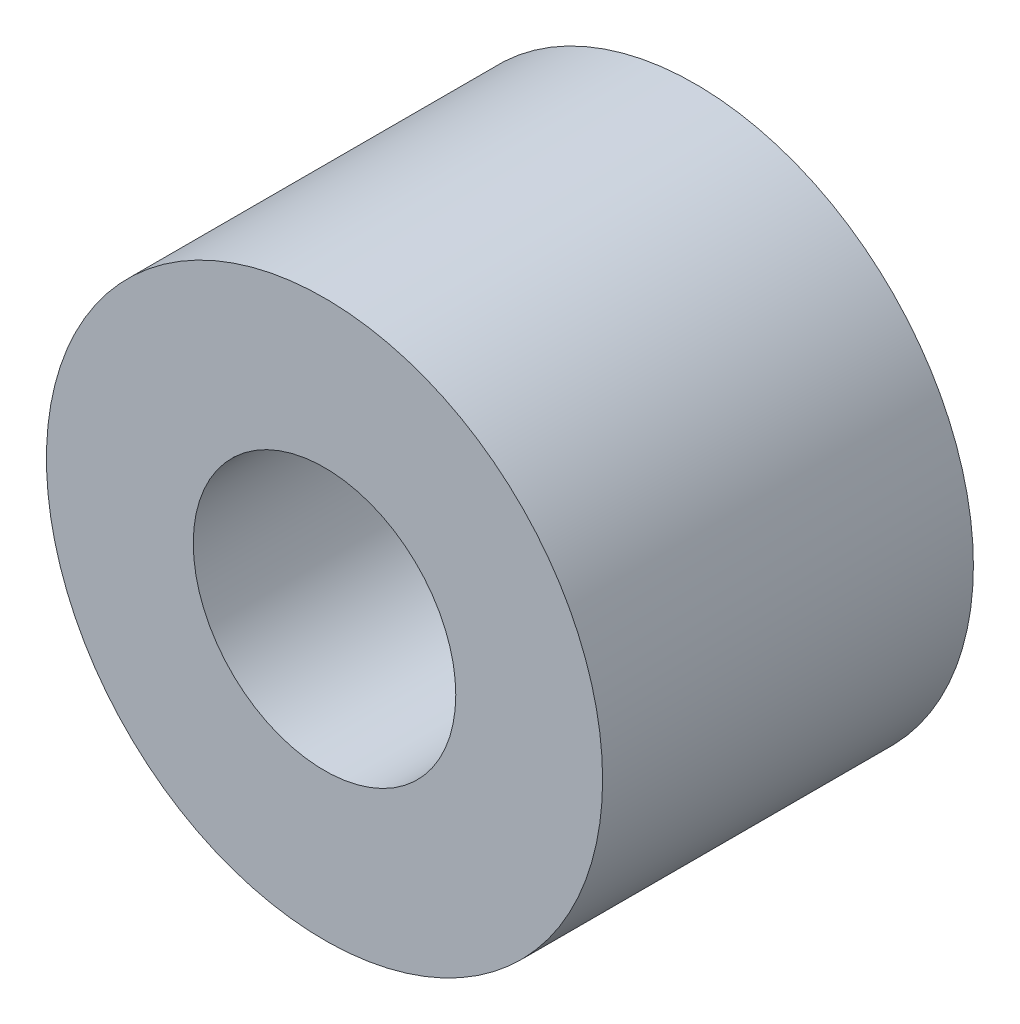
from build123d import *

# Parameters (mm, degrees)
SKETCH1_R           = 4.7625
SKETCH1_R_2         = 2.2479
BOSS_EXTRUDE1_DEPTH = 6.35


with BuildPart() as part:
    # Sketch1 → Boss-Extrude1 (new body)
    with BuildSketch(Plane.XY):
        Circle(SKETCH1_R)
        Circle(SKETCH1_R_2, mode=Mode.SUBTRACT)
    extrude(amount=BOSS_EXTRUDE1_DEPTH)


solid = part.part
